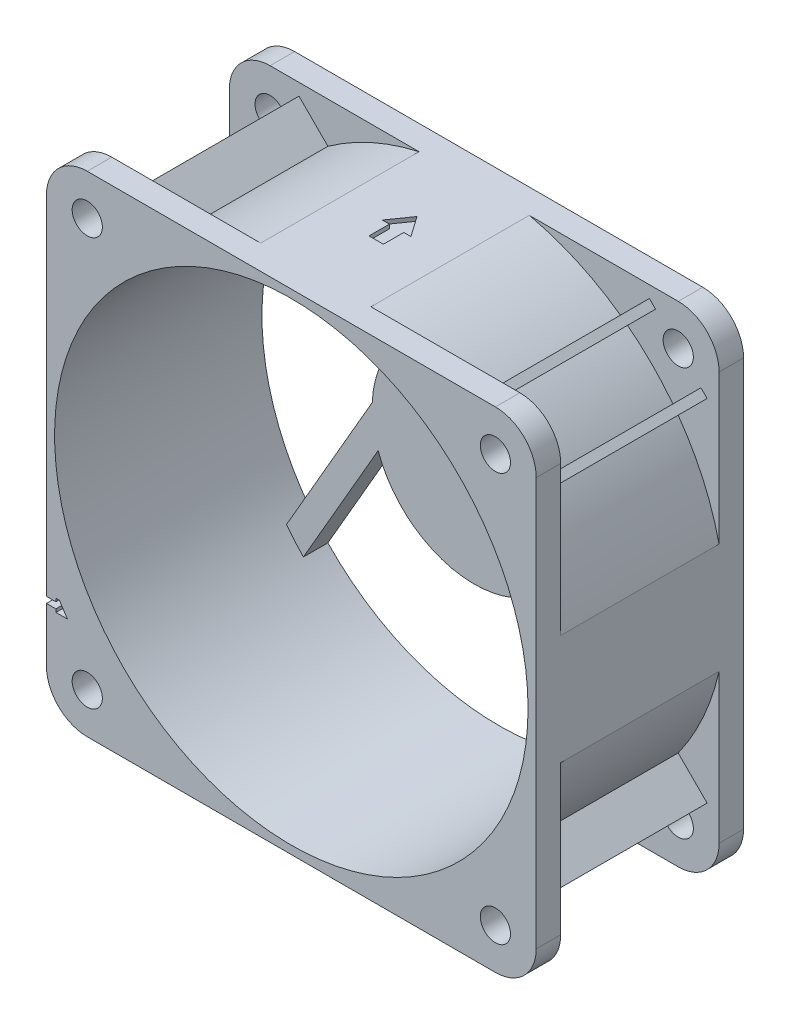
from build123d import *

# Parameters (mm, degrees)
SKETCH_BODY_R                       = 29
BODY_DEPTH                          = 25.4
SKETCH_CUT_BODY_W                   = 19.4
SKETCH_CUT_BODY_H                   = 9.605339059
REINFORCMENT_STRIP_REACH            = 51.449
CIRPATTERN_REINFORCMENT_STRIP_COUNT = 4
SKETCH_FIXING_HOLE_R                = 1.85
FIXING_HOLE_DEPTH                   = 50.44855913
CIRPATTERN_FIXING_HOLE_COUNT        = 4
BONE_DEPTH                          = 3
CIRPATTERN_BONE_COUNT               = 3
CUT_REINFORCMENT_STRIP_HOLE_DEPTH   = 22.4
SKETCH_FIXING_PLATE_FAN_R           = 12.5
FIXING_PLATE_FAN_DEPTH              = 3
AIR_EXHAUST_DEPTH                   = 72.312060691


with BuildPart() as part:
    # Sketch-Body → Body (new body)
    with BuildSketch(Plane.XY):
        with BuildLine():
            Line((-25, -30), (25, -30))
            ThreePointArc((25, -30), (28.535533906, -28.535533906), (30, -25))
            Line((30, -25), (30, 25))
            ThreePointArc((30, 25), (28.535533906, 28.535533906), (25, 30))
            Line((25, 30), (-25, 30))
            ThreePointArc((-25, 30), (-28.535533906, 28.535533906), (-30, 25))
            Line((-30, 25), (-30, -25))
            ThreePointArc((-30, -25), (-28.535533906, -28.535533906), (-25, -30))
        make_face()
        Circle(SKETCH_BODY_R, mode=Mode.SUBTRACT)
    extrude(amount=BODY_DEPTH)

    # Sketch-Cut-Body → Cut-Body (revolve, cut)
    with BuildSketch(Plane(origin=(0, 0, 0), x_dir=(0, 0, -1), z_dir=(1, 0, 0))):
        with Locations((-12.7, 35.55266953)):
            Rectangle(SKETCH_CUT_BODY_W, SKETCH_CUT_BODY_H)
    revolve(axis=Axis((0, 0, 25.4), (0, 0, -1)), mode=Mode.SUBTRACT)

    # Sketch-Reinforcment-Strip → Reinforcment-Strip (add, up to next)
    with BuildSketch(Plane.XY, mode=Mode.PRIVATE) as reinforcment_strip_sk1:
        with BuildLine():
            Line((24.452034569, 17.380966757), (28.535533906, 21.464466094))
            Line((28.535533906, 21.464466094), (27.779609669, 22.220390331))
            Line((27.779609669, 22.220390331), (23.809915661, 18.250696322))
            ThreePointArc((23.809915661, 18.250696322), (24.13489315, 17.818724214), (24.452034569, 17.380966757))
        make_face()
    reinforcment_strip_tool1 = extrude(reinforcment_strip_sk1.sketch, amount=REINFORCMENT_STRIP_REACH, mode=Mode.PRIVATE) - part.part
    # Sketch-Reinforcment-Strip → Reinforcment-Strip (add, up to next)
    with BuildSketch(Plane.XY, mode=Mode.PRIVATE) as reinforcment_strip_sk2:
        with BuildLine():
            Line((17.380966757, 24.452034569), (21.464466094, 28.535533906))
            Line((21.464466094, 28.535533906), (22.220390331, 27.779609669))
            Line((22.220390331, 27.779609669), (18.250696322, 23.809915661))
            ThreePointArc((18.250696322, 23.809915661), (17.818724214, 24.13489315), (17.380966757, 24.452034569))
        make_face()
    reinforcment_strip_tool2 = extrude(reinforcment_strip_sk2.sketch, amount=REINFORCMENT_STRIP_REACH, mode=Mode.PRIVATE) - part.part
    reinforcment_strip_1 = reinforcment_strip_tool1.solids().sort_by_distance((26.147081, 19.828375, 0))[0]
    add(reinforcment_strip_1)
    reinforcment_strip_2 = reinforcment_strip_tool2.solids().sort_by_distance((19.828375, 26.147081, 0))[0]
    add(reinforcment_strip_2)
    reinforcment_strip = reinforcment_strip_1 + reinforcment_strip_2  # Reinforcment-Strip as one shape, for the pattern or mirror that repeats it

    # CirPattern-Reinforcment-Strip: Reinforcment-Strip ×4 about axis
    cirpattern_reinforcment_strip_axis = Axis((0, 0, 0), (0, 0, 1))
    for i in range(1, CIRPATTERN_REINFORCMENT_STRIP_COUNT):
        add(reinforcment_strip.rotate(cirpattern_reinforcment_strip_axis, i * 360 / CIRPATTERN_REINFORCMENT_STRIP_COUNT))

    # Sketch-Fixing-Hole → Fixing-Hole (cut, through all)
    with BuildSketch(Plane.XY):
        with Locations(Location((25, 25, 0), (0, 0, 90))):
            Circle(SKETCH_FIXING_HOLE_R)
    fixing_hole = extrude(amount=FIXING_HOLE_DEPTH, mode=Mode.SUBTRACT)

    # CirPattern-Fixing-Hole: Fixing-Hole ×4 about axis
    cirpattern_fixing_hole_axis = Axis((0, 0, 0), (0, 0, 1))
    for i in range(1, CIRPATTERN_FIXING_HOLE_COUNT):
        add(fixing_hole.rotate(cirpattern_fixing_hole_axis, i * 360 / CIRPATTERN_FIXING_HOLE_COUNT), mode=Mode.SUBTRACT)

    # Sketch-Bone → Bone (add)
    with BuildSketch(Plane.XY):
        with BuildLine():
            Line((-11.764259967, -4.225184898), (-20.920098492, -20.08356241))
            ThreePointArc((-20.920098492, -20.08356241), (-21.989386414, -18.906794681), (-22.992571288, -17.673190589))
            Line((-22.992571288, -17.673190589), (-12.489214378, 0.519157229))
            ThreePointArc((-12.489214378, 0.519157229), (-12.356575173, -1.888133998), (-11.764259967, -4.225184898))
        make_face()
    bone = extrude(amount=BONE_DEPTH)

    # CirPattern-Bone: Bone ×3 about axis
    cirpattern_bone_axis = Axis((0, 0, 0), (0, 0, 1))
    for i in range(1, CIRPATTERN_BONE_COUNT):
        add(bone.rotate(cirpattern_bone_axis, i * 360 / CIRPATTERN_BONE_COUNT))

    # Sketch1 → Cut-Reinforcment-Strip-Hole (cut)
    with BuildSketch(Plane.XY.offset(25.4)):
        with BuildLine():
            Line((-27.430592324, -18.724638365), (-28.841857513, -18.724638365))
            Line((-28.841857513, -18.724638365), (-28.841857513, -18.34833506))
            Line((-28.841857513, -18.34833506), (-30, -18.34833506))
            Line((-30, -18.34833506), (-30, -17.59572845))
            Line((-30, -17.59572845), (-28.841857513, -17.59572845))
            Line((-28.841857513, -17.59572845), (-28.841857513, -17.219425145))
            Line((-28.841857513, -17.219425145), (-28.399663287, -17.219425145))
            ThreePointArc((-28.399663287, -17.219425145), (-27.925271299, -17.978562235), (-27.430592324, -18.724638365))
        make_face()
    extrude(amount=-CUT_REINFORCMENT_STRIP_HOLE_DEPTH, mode=Mode.SUBTRACT)

    # Sketch-Fixing-Plate-Fan → Fixing-Plate-Fan (add)
    with BuildSketch(Plane.XY):
        Circle(SKETCH_FIXING_PLATE_FAN_R)
    extrude(amount=FIXING_PLATE_FAN_DEPTH)

    # Sketch4 → Air-Exhaust (cut, through all)
    with BuildSketch(Plane(origin=(0, 29.5, 0), x_dir=(-1, 0, 0), z_dir=(0, 1, 0))):
        Polygon((0.881634904, 15), (-0.881634904, 15), (-0.881634904, 12.5), (-1.750518846, 12.5), (0, 10), (1.750518846, 12.5), (0.881634904, 12.5), align=None)
    extrude(amount=AIR_EXHAUST_DEPTH, mode=Mode.SUBTRACT)


solid = part.part
